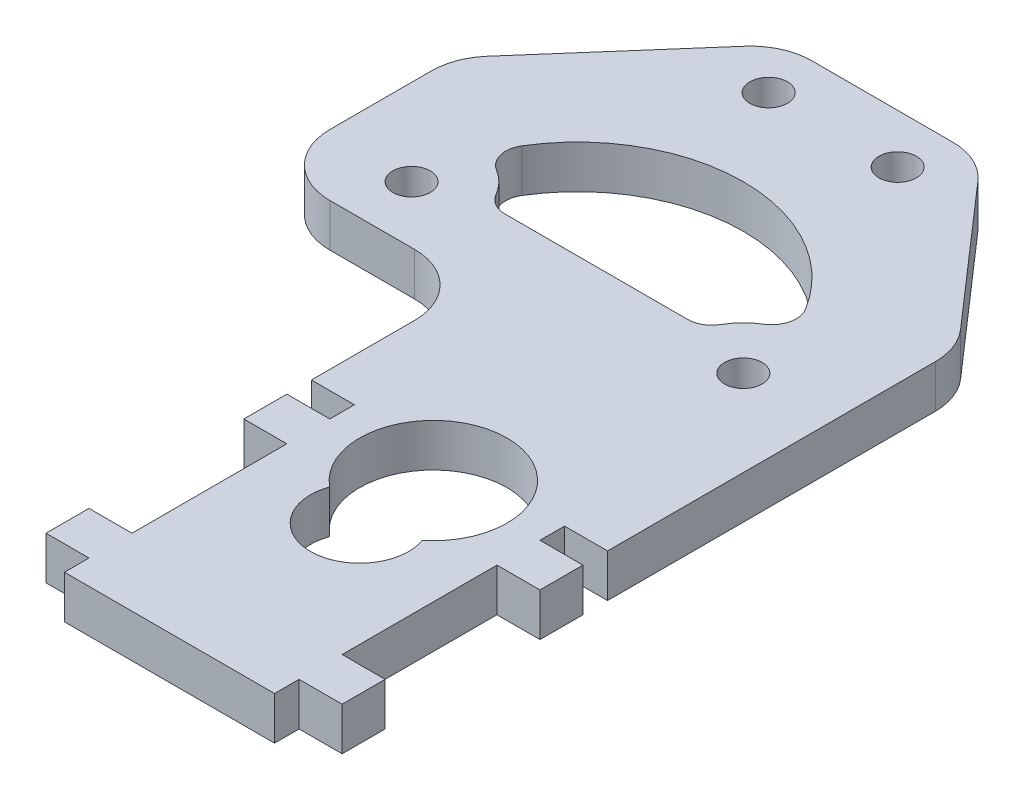
from build123d import *

# Parameters (mm, degrees)
SKETCH2_R           = 1.525
BOSS_EXTRUDE1_DEPTH = 3.5
FILLET1_R           = 5
FILLET2_R           = 2


with BuildPart() as part:
    # Sketch2 → Boss-Extrude1 (new body)
    with BuildSketch(Plane(origin=(0, 0, 0), x_dir=(1, 0, 0), z_dir=(0, 1, 0))):
        Polygon((-8, 29.459088021), (8, 29.459088021), (20.5, 15.15), (20.5, -13.4), (17, -13.4), (17, -15.4), (20.5, -15.4), (20.5, -18.9), (17, -18.9), (17, -31.5), (20.5, -31.5), (20.5, -35), (17, -35), (17, -37), (-0.1, -37), (-0.1, -35), (-3.6, -35), (-3.6, -31.5), (-0.1, -31.5), (-0.1, -18.9), (-3.6, -18.9), (-3.6, -15.4), (-0.1, -15.4), (-0.1, -13.4), (-3.6, -13.4), (-3.6, 0), (-20.5, 0), (-20.5, 15.15), align=None)
        with Locations(Location((-5.25, 25.459088021, 0), (0, 0, 270))):
            Circle(SKETCH2_R, mode=Mode.SUBTRACT)
        with Locations(Location((-13.5, 4.65, 0), (0, 0, 270))):
            Circle(SKETCH2_R, mode=Mode.SUBTRACT)
        with Locations(Location((13.5, 4.65, 0), (0, 0, 90))):
            Circle(SKETCH2_R, mode=Mode.SUBTRACT)
        with Locations(Location((5.25, 25.459088021, 0), (0, 0, 90))):
            Circle(SKETCH2_R, mode=Mode.SUBTRACT)
        with BuildLine():
            Line((8.711994152, 6.175), (-8.711994152, 6.175))
            ThreePointArc((-8.711994152, 6.175), (-10.168396205, 8.411786963), (-12.564791667, 9.587206738))
            ThreePointArc((-12.564791667, 9.587206738), (0, 18.15), (12.564791667, 9.587206738))
            ThreePointArc((12.564791667, 9.587206738), (10.168396205, 8.411786963), (8.711994152, 6.175))
        make_face(mode=Mode.SUBTRACT)
        with BuildLine():
            ThreePointArc((4.678763834, -20.194315192), (8.45, -25.527648525), (12.221236166, -20.194315192))
            ThreePointArc((12.221236166, -20.194315192), (8.45, -9.527648525), (4.678763834, -20.194315192))
        make_face(mode=Mode.SUBTRACT)
    extrude(amount=BOSS_EXTRUDE1_DEPTH)

    # Fillet1
    fillet1_edges = [part.edges().sort_by_distance(p)[0] for p in [
        (20.5, 1.75, -15.15),
        (-3.6, 1.75, 0),
        (-20.5, 1.75, 0),
        (-20.5, 1.75, -15.15),
        (-8, 1.75, -29.459088021),
        (8, 1.75, -29.459088021),
    ]]
    fillet(fillet1_edges, radius=FILLET1_R)

    # Fillet2
    fillet2_edges = [part.edges().sort_by_distance(p)[0] for p in [
        (-12.564791667, 1.75, -9.587206738),
        (-8.711994152, 1.75, -6.175),
        (8.711994152, 1.75, -6.175),
        (12.564791667, 1.75, -9.587206738),
    ]]
    fillet(fillet2_edges, radius=FILLET2_R)


solid = part.part
